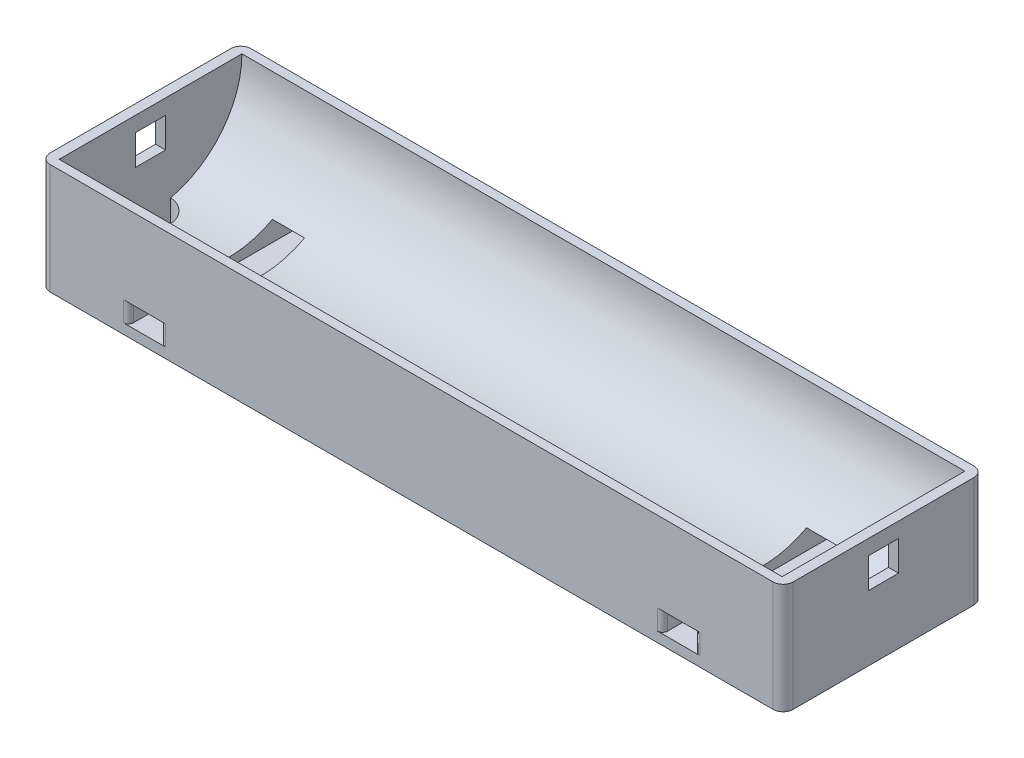
from build123d import *

# Parameters (mm, degrees)
ESBO_O1_W                = 74
ESBO_O1_H                = 20
RESSALTO_EXTRUS_O1_DEPTH = 11
ESBO_O4_W                = 72
ESBO_O4_H                = 9.1
ESBO_O5_W                = 3
ESBO_O5_H                = 3
CORTE_EXTRUS_O2_DEPTH    = 2.5
CORTE_EXTRUS_O3_DEPTH    = 40.874804075
FILETE1_R                = 1
FILETE2_R                = 1
FILETE3_R                = 1
FILETE4_R                = 1
ESBO_O8_W                = 3.2
ESBO_O8_H                = 2
CORTE_EXTRUS_O5_DEPTH    = 44.474130264
FILETE5_R                = 0.5
FILETE6_R                = 0.5
FILETE7_R                = 0.5
FILETE8_R                = 0.5
FILETE5_OF_ESPELHAR3_R   = 0.5
FILETE6_OF_ESPELHAR3_R   = 0.5
FILETE7_OF_ESPELHAR3_R   = 0.5
FILETE8_OF_ESPELHAR3_R   = 0.5


with BuildPart() as part:
    # Esboço1 → Ressalto-extrusão1 (new body)
    with BuildSketch(Plane(origin=(0, 0, 0), x_dir=(1, 0, 0), z_dir=(0, 1, 0))):
        Rectangle(ESBO_O1_W, ESBO_O1_H)
    extrude(amount=RESSALTO_EXTRUS_O1_DEPTH)

    # Esboço4 → Corte-Revolução2 (revolve, cut)
    with BuildSketch(Plane(origin=(0, 11, 0), x_dir=(1, 0, 0), z_dir=(0, 1, 0))):
        with Locations((0, -4.55)):
            Rectangle(ESBO_O4_W, ESBO_O4_H)
    revolve(axis=Axis((-38.336087416, 11, 0), (1, 0, 0)), mode=Mode.SUBTRACT)

    # Esboço5 → Corte-extrusão2 (cut)
    with BuildSketch(Plane(origin=(-36, 0, 0), x_dir=(0, 0, -1), z_dir=(1, 0, 0))):
        with Locations((0, 8)):
            Rectangle(ESBO_O5_W, ESBO_O5_H)
    corte_extrus_o2 = extrude(amount=-CORTE_EXTRUS_O2_DEPTH, mode=Mode.SUBTRACT)

    # Espelhar1: Corte-extrusão2 across plane
    add(corte_extrus_o2.mirror(Plane(origin=(0, 0, 0), x_dir=(0, 0, 1), z_dir=(1, 0, 0))), mode=Mode.SUBTRACT)

    # Esboço6 → Corte-extrusão3 (cut, through all)
    with BuildSketch(Plane(origin=(0, 0, 0), x_dir=(1, 0, 0), z_dir=(0, 1, 0))):
        with BuildLine():
            Line((-36, 2), (-36, -2))
            ThreePointArc((-36, -2), (-34, 0), (-36, 2))
        make_face()
    corte_extrus_o3 = extrude(amount=CORTE_EXTRUS_O3_DEPTH, mode=Mode.SUBTRACT)

    # Filete1
    filete1_edges = [part.edges().sort_by_distance(p)[0] for p in [
        (37, 5.5, 10),
    ]]
    fillet(filete1_edges, radius=FILETE1_R)

    # Filete2
    filete2_edges = [part.edges().sort_by_distance(p)[0] for p in [
        (37, 5.5, -10),
    ]]
    fillet(filete2_edges, radius=FILETE2_R)

    # Filete3
    filete3_edges = [part.edges().sort_by_distance(p)[0] for p in [
        (-37, 5.5, 10),
    ]]
    fillet(filete3_edges, radius=FILETE3_R)

    # Filete4
    filete4_edges = [part.edges().sort_by_distance(p)[0] for p in [
        (-37, 5.5, -10),
    ]]
    fillet(filete4_edges, radius=FILETE4_R)

    # Espelhar2: Corte-extrusão3 across plane
    add(corte_extrus_o3.mirror(Plane(origin=(0, 0, 0), x_dir=(0, 0, 1), z_dir=(1, 0, 0))), mode=Mode.SUBTRACT)

    # Esboço8 → Corte-extrusão5 (cut, through all)
    with BuildSketch(Plane.XY.offset(10)):
        with Locations((-26.6, 2)):
            Rectangle(ESBO_O8_W, ESBO_O8_H)
    corte_extrus_o5 = extrude(amount=-CORTE_EXTRUS_O5_DEPTH, mode=Mode.SUBTRACT)

    # Filete5
    filete5_edges = [part.edges().sort_by_distance(p)[0] for p in [
        (-28.2, 2, 10),
    ]]
    fillet(filete5_edges, radius=FILETE5_R)

    # Filete6
    filete6_edges = [part.edges().sort_by_distance(p)[0] for p in [
        (-25, 2, 10),
    ]]
    fillet(filete6_edges, radius=FILETE6_R)

    # Filete7
    filete7_edges = [part.edges().sort_by_distance(p)[0] for p in [
        (-25, 2, -10),
    ]]
    fillet(filete7_edges, radius=FILETE7_R)

    # Filete8
    filete8_edges = [part.edges().sort_by_distance(p)[0] for p in [
        (-28.2, 2, -10),
    ]]
    fillet(filete8_edges, radius=FILETE8_R)

    # Espelhar3: Corte-extrusão5 across plane
    add(corte_extrus_o5.mirror(Plane(origin=(0, 0, 0), x_dir=(0, 0, 1), z_dir=(1, 0, 0))), mode=Mode.SUBTRACT)

    # Filete5 of Espelhar3
    filete5_of_espelhar3_edges = [part.edges().sort_by_distance(p)[0] for p in [
        (28.2, 2, 10),
    ]]
    fillet(filete5_of_espelhar3_edges, radius=FILETE5_OF_ESPELHAR3_R)

    # Filete6 of Espelhar3
    filete6_of_espelhar3_edges = [part.edges().sort_by_distance(p)[0] for p in [
        (25, 2, 10),
    ]]
    fillet(filete6_of_espelhar3_edges, radius=FILETE6_OF_ESPELHAR3_R)

    # Filete7 of Espelhar3
    filete7_of_espelhar3_edges = [part.edges().sort_by_distance(p)[0] for p in [
        (25, 2, -10),
    ]]
    fillet(filete7_of_espelhar3_edges, radius=FILETE7_OF_ESPELHAR3_R)

    # Filete8 of Espelhar3
    filete8_of_espelhar3_edges = [part.edges().sort_by_distance(p)[0] for p in [
        (28.2, 2, -10),
    ]]
    fillet(filete8_of_espelhar3_edges, radius=FILETE8_OF_ESPELHAR3_R)


solid = part.part
